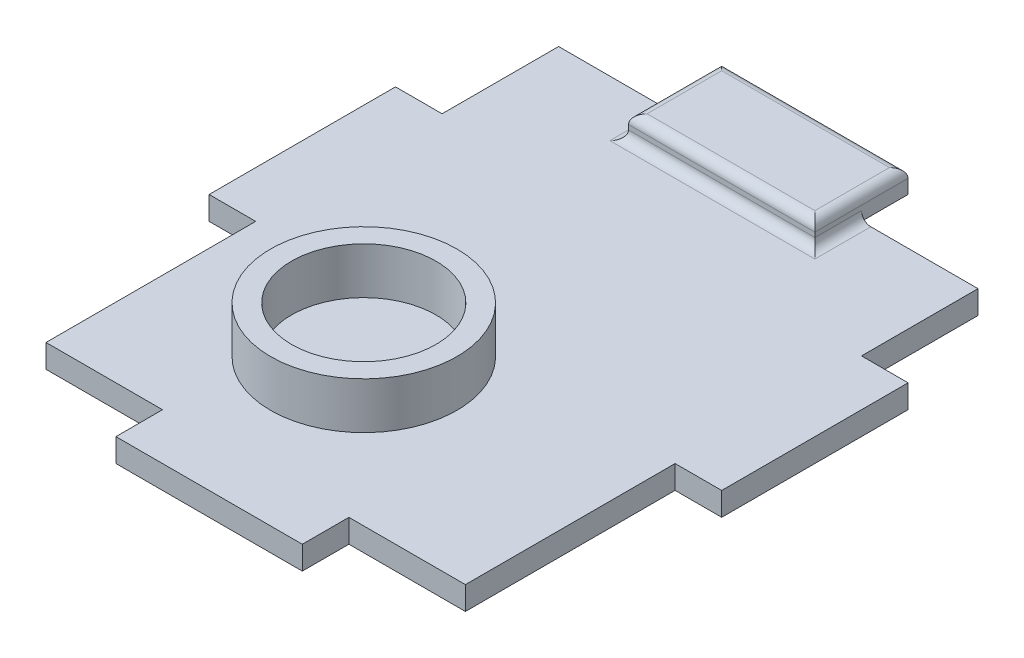
from build123d import *

# Parameters (mm, degrees)
SKETCH1_W           = 90
SKETCH1_H           = 110
SKETCH1_W_2         = 10
SKETCH1_H_2         = 40
SKETCH1_W_3         = 40
SKETCH1_H_3         = 10
BOSS_EXTRUDE1_DEPTH = 5
SKETCH4_R           = 20
SKETCH4_R_2         = 15.5
BOSS_EXTRUDE2_DEPTH = 10
SKETCH5_W           = 40
SKETCH5_H           = 20
BOSS_EXTRUDE3_DEPTH = 5
FILLET1_R           = 2


with BuildPart() as part:
    # Sketch1 → Boss-Extrude1 (new body)
    with BuildSketch(Plane(origin=(0, 0, 0), x_dir=(1, 0, 0), z_dir=(0, 1, 0))):
        with Locations((45, 55)):
            Rectangle(SKETCH1_W, SKETCH1_H)
        with Locations((-5, 65)):
            Rectangle(SKETCH1_W_2, SKETCH1_H_2)
        with Locations((95, 65)):
            Rectangle(SKETCH1_W_2, SKETCH1_H_2)
        with Locations((45, -5)):
            Rectangle(SKETCH1_W_3, SKETCH1_H_3)
    extrude(amount=BOSS_EXTRUDE1_DEPTH)

    # Sketch4 → Boss-Extrude2 (add)
    with BuildSketch(Plane(origin=(0, 5, 0), x_dir=(1, 0, 0), z_dir=(0, 1, 0))):
        with Locations(Location((36.72, 31.47, 0), (0, 0, 270))):
            Circle(SKETCH4_R)
        with Locations(Location((36.72, 31.47, 0), (0, 0, 270))):
            Circle(SKETCH4_R_2, mode=Mode.SUBTRACT)
    extrude(amount=BOSS_EXTRUDE2_DEPTH)

    # Sketch5 → Boss-Extrude3 (add)
    with BuildSketch(Plane(origin=(0, 5, 0), x_dir=(1, 0, 0), z_dir=(0, 1, 0))):
        with Locations((45, 110)):
            Rectangle(SKETCH5_W, SKETCH5_H)
    extrude(amount=BOSS_EXTRUDE3_DEPTH)

    # Fillet1
    fillet1_edges = [part.edges().sort_by_distance(p)[0] for p in [
        (25, 5, -105),
        (45, 5, -100),
        (65, 5, -105),
        (25, 10, -110),
        (45, 10, -100),
        (65, 10, -110),
        (45, 10, -120),
    ]]
    fillet(fillet1_edges, radius=FILLET1_R)


solid = part.part
